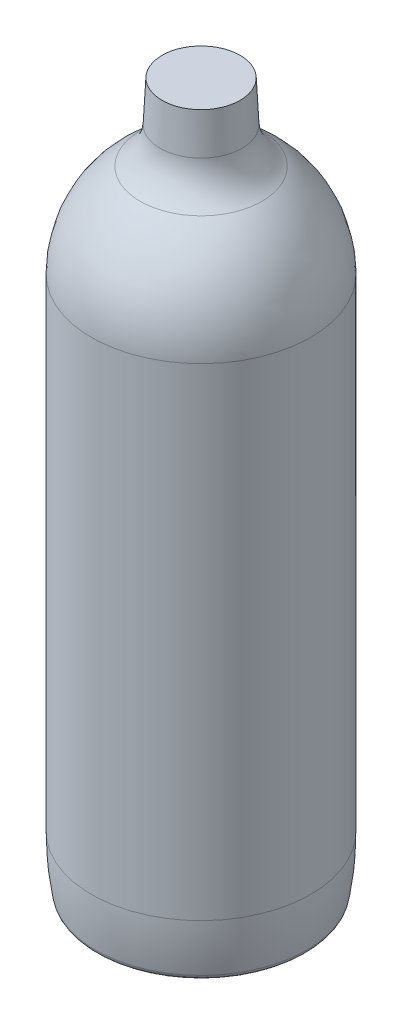
from build123d import *


with BuildPart() as part:
    # Skica1 → Rotovat1 (revolve)
    with BuildSketch(Plane.XY, mode=Mode.PRIVATE) as rotovat1_sk:
        with BuildLine():
            Line((-2, 9.937438845), (0, 9.937438845))
            Line((0, 9.937438845), (0, 231))
            Line((0, 231), (-12.618810271, 231))
            ThreePointArc((-12.618810271, 231), (-12.903232124, 224.440073791), (-13.253405947, 217.883328719))
            ThreePointArc((-13.253405947, 217.883328719), (-15.159184085, 211.33843471), (-19.721855633, 206.273885742))
            ThreePointArc((-19.721855633, 206.273885742), (-31.283356959, 193.057862433), (-35.45, 176))
            Line((-35.45, 176), (-35.45, 20))
            ThreePointArc((-35.45, 20), (-35.094324076, 11.796758267), (-34.029965847, 3.655086334))
            ThreePointArc((-34.029965847, 3.655086334), (-33.114653771, 2.300717404), (-31.494757975, 2.081516571))
            Line((-31.494757975, 2.081516571), (-9.042779517, 8.69573486))
            ThreePointArc((-9.042779517, 8.69573486), (-5.556185927, 9.513946086), (-2, 9.937438845))
        make_face()
    revolve(rotovat1_sk.sketch.rotate(Axis((0, 0, 0), (0, 1, 0)), 270), axis=Axis((0, 0, 0), (0, 1, 0)))


solid = part.part
